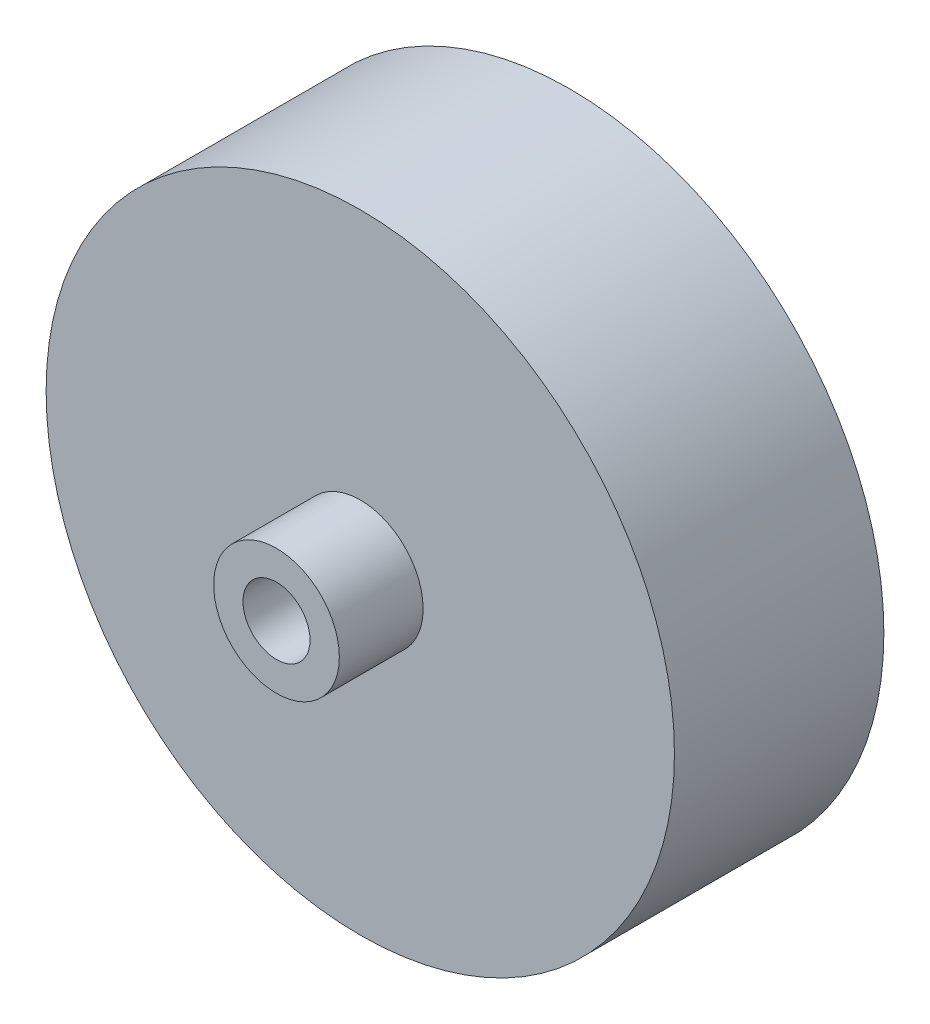
from build123d import *

# Parameters (mm, degrees)
SKETCH1_R           = 37.5
BOSS_EXTRUDE1_DEPTH = 25
SKETCH2_R           = 7.5
SKETCH2_R_2         = 4
BOSS_EXTRUDE2_DEPTH = 10


with BuildPart() as part:
    # Sketch1 → Boss-Extrude1 (new body)
    with BuildSketch(Plane.XY):
        Circle(SKETCH1_R)
    extrude(amount=BOSS_EXTRUDE1_DEPTH)

    # Sketch2 → Boss-Extrude2 (add)
    with BuildSketch(Plane.XY.offset(25)):
        Circle(SKETCH2_R)
        Circle(SKETCH2_R_2, mode=Mode.SUBTRACT)
    extrude(amount=BOSS_EXTRUDE2_DEPTH)


solid = part.part
